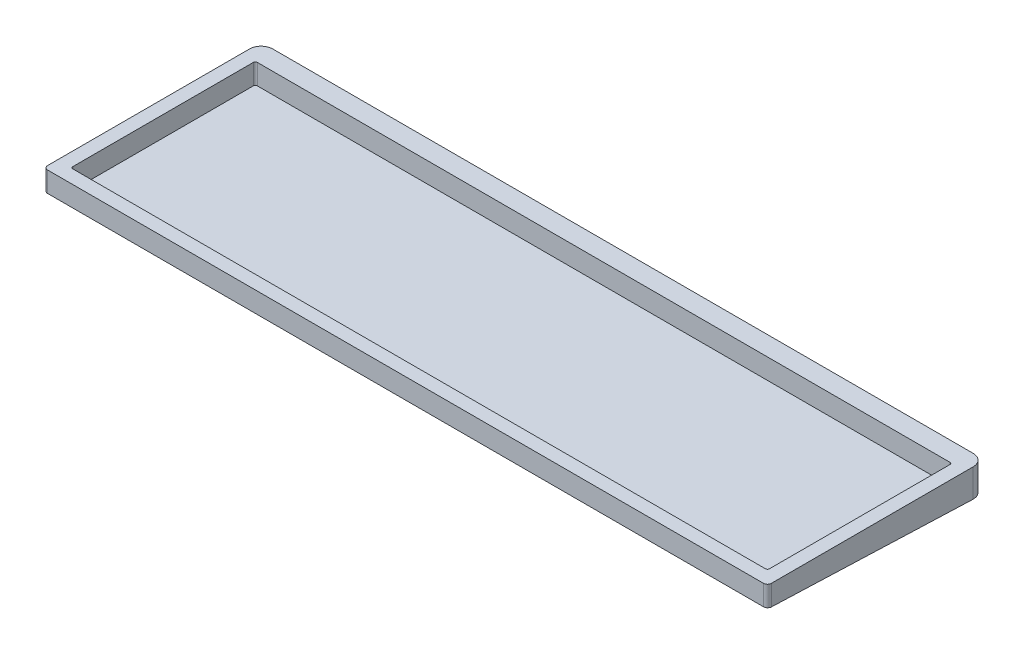
from build123d import *

# Parameters (mm, degrees)
BOSS_EXTRUDE1_DEPTH = 10.5
BOSS_EXTRUDE3_START = 10.5
BOSS_EXTRUDE3_DEPTH = 10.5
SKETCH5_W           = 6
SKETCH5_H           = 6.5
CUT_EXTRUDE1_DEPTH  = 400
CUT_EXTRUDE2_DEPTH  = 40
CUT_EXTRUDE3_DEPTH  = 40


with BuildPart() as part:
    # Sketch2 → Boss-Extrude1 (new body)
    with BuildSketch(Plane(origin=(0, 0, 0), x_dir=(1, 0, 0), z_dir=(0, 1, 0))):
        with BuildLine():
            Line((-186.825, 51.625), (-186.825, -52.625))
            ThreePointArc((-186.825, -52.625), (-186.239213562, -54.039213562), (-184.825, -54.625))
            Line((-184.825, -54.625), (184.825, -54.625))
            ThreePointArc((184.825, -54.625), (186.239213562, -54.039213562), (186.825, -52.625))
            Line((186.825, -52.625), (186.825, 51.625))
            ThreePointArc((186.825, 51.625), (185.067640687, 55.867640687), (180.825, 57.625))
            Line((180.825, 57.625), (-180.825, 57.625))
            ThreePointArc((-180.825, 57.625), (-185.067640687, 55.867640687), (-186.825, 51.625))
        make_face()
        with BuildLine():
            ThreePointArc((-178.825, 47.625), (-179.532106781, 47.332106781), (-179.825, 46.625))
            Line((-179.825, 46.625), (-179.825, -46.625))
            ThreePointArc((-179.825, -46.625), (-179.532106781, -47.332106781), (-178.825, -47.625))
            Line((-178.825, -47.625), (178.825, -47.625))
            ThreePointArc((178.825, -47.625), (179.532106781, -47.332106781), (179.825, -46.625))
            Line((179.825, -46.625), (179.825, 46.625))
            ThreePointArc((179.825, 46.625), (179.532106781, 47.332106781), (178.825, 47.625))
            Line((178.825, 47.625), (-178.825, 47.625))
        make_face(mode=Mode.SUBTRACT)
    extrude(amount=BOSS_EXTRUDE1_DEPTH)

    # Sketch4 → Boss-Extrude3 (add)
    # profile 1 of 2: a face of its own
    with BuildSketch(Plane.XZ.offset(BOSS_EXTRUDE3_START)):
        with BuildLine():
            ThreePointArc((-184.825, 54.625), (-186.239213562, 54.039213562), (-186.825, 52.625))
            Line((-186.825, 52.625), (-186.825, -51.625))
            ThreePointArc((-186.825, -51.625), (-185.067640687, -55.867640687), (-180.825, -57.625))
            Line((-180.825, -57.625), (180.825, -57.625))
            ThreePointArc((180.825, -57.625), (185.067640687, -55.867640687), (186.825, -51.625))
            Line((186.825, -51.625), (186.825, 52.625))
            ThreePointArc((186.825, 52.625), (186.239213562, 54.039213562), (184.825, 54.625))
            Line((184.825, 54.625), (-184.825, 54.625))
        make_face()
        with BuildLine():
            Line((178.825, -47.625), (-178.825, -47.625))
            ThreePointArc((-178.825, -47.625), (-179.532106781, -47.332106781), (-179.825, -46.625))
            Line((-179.825, -46.625), (-179.825, 46.625))
            ThreePointArc((-179.825, 46.625), (-179.532106781, 47.332106781), (-178.825, 47.625))
            Line((-178.825, 47.625), (178.825, 47.625))
            ThreePointArc((178.825, 47.625), (179.532106781, 47.332106781), (179.825, 46.625))
            Line((179.825, 46.625), (179.825, -46.625))
            ThreePointArc((179.825, -46.625), (179.532106781, -47.332106781), (178.825, -47.625))
        make_face(mode=Mode.SUBTRACT)
    # profile 2 of 2: a face of its own
    with BuildSketch(Plane.XZ.offset(BOSS_EXTRUDE3_START)):
        with BuildLine():
            ThreePointArc((-178.825, -47.625), (-179.532106781, -47.332106781), (-179.825, -46.625))
            Line((-179.825, -46.625), (-179.825, 46.625))
            ThreePointArc((-179.825, 46.625), (-179.532106781, 47.332106781), (-178.825, 47.625))
            Line((-178.825, 47.625), (178.825, 47.625))
            ThreePointArc((178.825, 47.625), (179.532106781, 47.332106781), (179.825, 46.625))
            Line((179.825, 46.625), (179.825, -46.625))
            ThreePointArc((179.825, -46.625), (179.532106781, -47.332106781), (178.825, -47.625))
            Line((178.825, -47.625), (-178.825, -47.625))
        make_face()
    extrude(amount=-BOSS_EXTRUDE3_DEPTH)

    # Sketch5 → Cut-Extrude1 (cut)
    with BuildSketch(Plane(origin=(186.825, 0, 0), x_dir=(0, 0, -1), z_dir=(1, 0, 0))):
        Polygon((-52.625, -10.5), (-52.625, -0.219727509), (-54.625, 0), (-54.625, -10.5), align=None)
        Polygon((-52.625, -10.5), (40.947921748, -10.5), (-52.625, -0.219727509), align=None)
        Polygon((51.625, -10.5), (51.625, -4), (40.947921748, -10.5), align=None)
        with Locations((54.625, -7.25)):
            Rectangle(SKETCH5_W, SKETCH5_H)
    extrude(amount=-CUT_EXTRUDE1_DEPTH, mode=Mode.SUBTRACT)

    # Sketch6 → Cut-Extrude2 (cut)
    with BuildSketch(Plane(origin=(186.825, 0, 0), x_dir=(0, 0, -1), z_dir=(1, 0, 0))):
        Polygon((-54.625, 0), (51.625, -4), (40.947921748, -10.5), align=None)
    extrude(amount=-CUT_EXTRUDE2_DEPTH, mode=Mode.SUBTRACT)

    # Sketch7 → Cut-Extrude3 (cut)
    with BuildSketch(Plane.ZY.offset(186.825)):
        Polygon((-51.625, -4), (-40.947921748, -10.5), (52.625, -0.219727509), align=None)
    extrude(amount=-CUT_EXTRUDE3_DEPTH, mode=Mode.SUBTRACT)


solid = part.part
